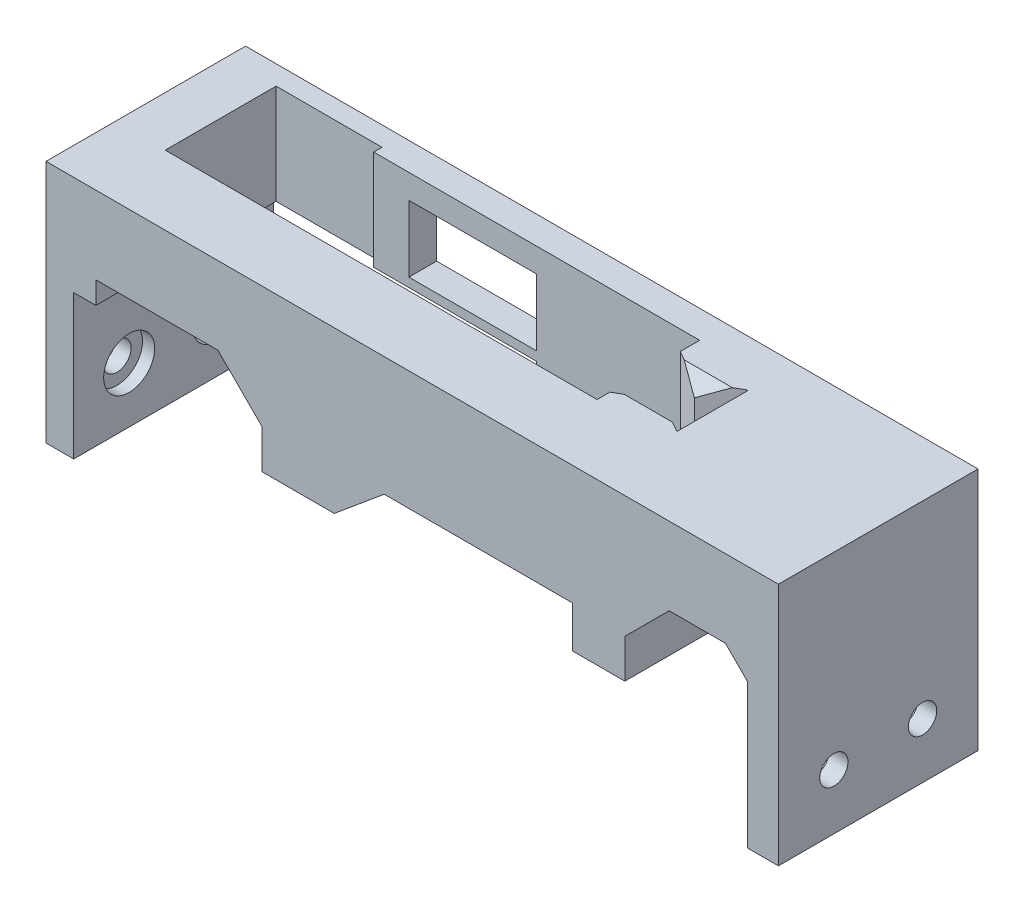
from build123d import *

# Parameters (mm, degrees)
SKETCH1_W                      = 132.1
SKETCH1_H                      = 36
BOSS_EXTRUDE1_DEPTH            = 44
CUT_EXTRUDE1_REACH             = 89.147
CUT_EXTRUDE2_REACH             = 89.147
SKETCH3_4_W                    = 23.05
SKETCH3_4_H                    = 12
SKETCH3_4_W_2                  = 52.5
SKETCH3_4_H_2                  = 26
CUT_EXTRUDE3_DEPTH             = 12.5
CUT_EXTRUDE6_DEPTH             = 7.5
CUT_EXTRUDE7_REACH             = 101.054
CUT_EXTRUDE8_REACH             = 137.7
SKETCH11_R                     = 2.55
CUT_EXTRUDE8_DIRECTION_2_REACH = 137.7
SKETCH11_6_R                   = 4.6
SKETCH11_6_R_2                 = 2.55
CUT_EXTRUDE10_DEPTH            = 2.2
CUT_EXTRUDE11_START            = 123.73
SKETCH11_7_R                   = 4.6
SKETCH11_7_R_2                 = 2.55
CUT_EXTRUDE11_DEPTH            = 2.2


with BuildPart() as part:
    # Sketch1 → Boss-Extrude1 (new body)
    with BuildSketch(Plane(origin=(0, 0, 0), x_dir=(1, 0, 0), z_dir=(0, 1, 0))):
        Rectangle(SKETCH1_W, SKETCH1_H)
        Polygon((-57.05, 14.5), (-57.05, -5.5), (20.85, -5.5), (20.85, -3.2), (26.85, 0.267693758), (32.85, -3.2), (33.05, -3.2), (33.05, 9.51), (32.85, 9.51), (26.85, 6.042306242), (20.85, 9.51), (20.85, 13), (-37.95, 13), (-37.95, 14.5), align=None, mode=Mode.SUBTRACT)
    extrude(amount=-BOSS_EXTRUDE1_DEPTH)

    # Cut-Extrude1: up to this face of the body (flat: up to its plane)
    cut_extrude1_end = Plane(part.part.faces().sort_by_distance((0, -22, 18))[0])
    # Sketch3 → Cut-Extrude1 (cut, up to the picked face)
    with BuildSketch(Plane(origin=(0, 0, -18), x_dir=(-1, 0, 0), z_dir=(0, 0, -1)), mode=Mode.PRIVATE) as cut_extrude1_sk1:
        Polygon((-60.48, -18), (-60.48, -44), (-20.85, -44), (-20.85, -29), (-38.35, -29), (-38.35, -22), (-46.35, -14), (-56.48, -14), align=None)
    cut_extrude1_tool1 = split(extrude(cut_extrude1_sk1.sketch, amount=-CUT_EXTRUDE1_REACH, mode=Mode.PRIVATE), bisect_by=cut_extrude1_end, keep=Keep.BOTH, mode=Mode.PRIVATE)
    add(cut_extrude1_tool1.solids().sort_by(Axis((43.76231, -31.789655, -18), (0, 0, 1)))[0], mode=Mode.SUBTRACT)

    # Cut-Extrude2: up to this face of the body (flat: up to its plane)
    cut_extrude2_end = Plane(part.part.faces().sort_by_distance((-18.1, -22, 5.5))[0])
    # Sketch3<4> → Cut-Extrude2 (cut, up to the picked face)
    with BuildSketch(Plane(origin=(0, 0, -18), x_dir=(-1, 0, 0), z_dir=(0, 0, -1)), mode=Mode.PRIVATE) as cut_extrude2_sk1:
        with Locations((20.075, -10.36)):
            Rectangle(SKETCH3_4_W, SKETCH3_4_H)
    cut_extrude2_tool1 = split(extrude(cut_extrude2_sk1.sketch, amount=-CUT_EXTRUDE2_REACH, mode=Mode.PRIVATE), bisect_by=cut_extrude2_end, keep=Keep.BOTH, mode=Mode.PRIVATE)
    # Sketch3<4> → Cut-Extrude2 (cut, up to the picked face)
    with BuildSketch(Plane(origin=(0, 0, -18), x_dir=(-1, 0, 0), z_dir=(0, 0, -1)), mode=Mode.PRIVATE) as cut_extrude2_sk2:
        with Locations((34.8, -31)):
            Rectangle(SKETCH3_4_W_2, SKETCH3_4_H_2)
    cut_extrude2_tool2 = split(extrude(cut_extrude2_sk2.sketch, amount=-CUT_EXTRUDE2_REACH, mode=Mode.PRIVATE), bisect_by=cut_extrude2_end, keep=Keep.BOTH, mode=Mode.PRIVATE)
    add(cut_extrude2_tool1.solids().sort_by(Axis((-20.075, -10.36, -18), (0, 0, 1)))[0], mode=Mode.SUBTRACT)
    add(cut_extrude2_tool2.solids().sort_by(Axis((-34.8, -31, -18), (0, 0, 1)))[0], mode=Mode.SUBTRACT)

    # Sketch4 → Cut-Extrude3 (cut)
    with BuildSketch(Plane.XY.offset(18)):
        Polygon((-61.05, -44), (-61.05, -18), (-57.05, -18), (-57.05, -14), (-35.05, -14), (-27.05, -22), (-27.05, -29), (-14.05, -29), (-5.05, -21.5), (20.85, -21.5), (20.85, -29), (20.85, -44), align=None)
    extrude(amount=-CUT_EXTRUDE3_DEPTH, mode=Mode.SUBTRACT)

    # Sketch7 → Cut-Extrude6 (cut)
    with BuildSketch(Plane.XZ.offset(29)):
        Polygon((20.85, 3.2), (23.35, 5.7), (23.35, 8), (29.35, 8), (28.95, 18), (20.85, 18), align=None)
    extrude(amount=-CUT_EXTRUDE6_DEPTH, mode=Mode.SUBTRACT)

    # Cut-Extrude7: up to this face of the body (flat: up to its plane)
    cut_extrude7_end = Plane(part.part.faces().sort_by_distance((33.05, -14.5, -3.155))[0])
    # Sketch10 → Cut-Extrude7 (cut, up to the picked face)
    with BuildSketch(Plane.ZY.offset(-20.85), mode=Mode.PRIVATE) as cut_extrude7_sk1:
        Polygon((-8.552306242, 0), (-6.042306242, 0), (-6.042306242, -2.51), align=None)
    cut_extrude7_tool1 = split(extrude(cut_extrude7_sk1.sketch, amount=-CUT_EXTRUDE7_REACH, mode=Mode.PRIVATE), bisect_by=cut_extrude7_end, keep=Keep.BOTH, mode=Mode.PRIVATE)
    # Sketch10 → Cut-Extrude7 (cut, up to the picked face)
    with BuildSketch(Plane.ZY.offset(-20.85), mode=Mode.PRIVATE) as cut_extrude7_sk2:
        Polygon((-0.267693758, 0), (-0.267693758, -2.51), (2.242306242, 0), align=None)
    cut_extrude7_tool2 = split(extrude(cut_extrude7_sk2.sketch, amount=-CUT_EXTRUDE7_REACH, mode=Mode.PRIVATE), bisect_by=cut_extrude7_end, keep=Keep.BOTH, mode=Mode.PRIVATE)
    # Sketch10 → Cut-Extrude7 (cut, up to the picked face)
    with BuildSketch(Plane.ZY.offset(-20.85), mode=Mode.PRIVATE) as cut_extrude7_sk3:
        Polygon((-9.51, -29), (-6.042306242, -25.532306242), (-6.042306242, -29), align=None)
    cut_extrude7_tool3 = split(extrude(cut_extrude7_sk3.sketch, amount=-CUT_EXTRUDE7_REACH, mode=Mode.PRIVATE), bisect_by=cut_extrude7_end, keep=Keep.BOTH, mode=Mode.PRIVATE)
    # Sketch10 → Cut-Extrude7 (cut, up to the picked face)
    with BuildSketch(Plane.ZY.offset(-20.85), mode=Mode.PRIVATE) as cut_extrude7_sk4:
        Polygon((-0.267693758, -25.532306242), (-0.267693758, -29), (3.2, -29), align=None)
    cut_extrude7_tool4 = split(extrude(cut_extrude7_sk4.sketch, amount=-CUT_EXTRUDE7_REACH, mode=Mode.PRIVATE), bisect_by=cut_extrude7_end, keep=Keep.BOTH, mode=Mode.PRIVATE)
    add(cut_extrude7_tool1.solids().sort_by(Axis((20.85, -0.836667, -6.878973), (1, 0, 0)))[0], mode=Mode.SUBTRACT)
    add(cut_extrude7_tool2.solids().sort_by(Axis((20.85, -0.836667, 0.568973), (1, 0, 0)))[0], mode=Mode.SUBTRACT)
    add(cut_extrude7_tool3.solids().sort_by(Axis((20.85, -27.844102, -7.198204), (1, 0, 0)))[0], mode=Mode.SUBTRACT)
    add(cut_extrude7_tool4.solids().sort_by(Axis((20.85, -27.844102, 0.888204), (1, 0, 0)))[0], mode=Mode.SUBTRACT)

    # Cut-Extrude8: up to this face of the body (flat: up to its plane)
    cut_extrude8_end = Plane(part.part.faces().sort_by_distance((-66.05, -22, 0))[0])
    # Sketch11 → Cut-Extrude8 (cut, up to the picked face)
    with BuildSketch(Plane(origin=(-61.05, 0, 0), x_dir=(0, 0, -1), z_dir=(1, 0, 0)), mode=Mode.PRIVATE) as cut_extrude8_sk1:
        with Locations((-8, -34)):
            Circle(SKETCH11_R)
    cut_extrude8_tool1 = split(extrude(cut_extrude8_sk1.sketch, amount=-CUT_EXTRUDE8_REACH, mode=Mode.PRIVATE), bisect_by=cut_extrude8_end, keep=Keep.BOTH, mode=Mode.PRIVATE)
    # Sketch11 → Cut-Extrude8 (cut, up to the picked face)
    with BuildSketch(Plane(origin=(-61.05, 0, 0), x_dir=(0, 0, -1), z_dir=(1, 0, 0)), mode=Mode.PRIVATE) as cut_extrude8_sk2:
        with Locations((8, -34)):
            Circle(SKETCH11_R)
    cut_extrude8_tool2 = split(extrude(cut_extrude8_sk2.sketch, amount=-CUT_EXTRUDE8_REACH, mode=Mode.PRIVATE), bisect_by=cut_extrude8_end, keep=Keep.BOTH, mode=Mode.PRIVATE)
    add(cut_extrude8_tool1.solids().sort_by(Axis((-61.05, -34, 8), (-1, 0, 0)))[0], mode=Mode.SUBTRACT)
    add(cut_extrude8_tool2.solids().sort_by(Axis((-61.05, -34, -8), (-1, 0, 0)))[0], mode=Mode.SUBTRACT)

    # Cut-Extrude8 direction 2: up to this face of the body (flat: up to its plane)
    cut_extrude8_direction_2_end = Plane(part.part.faces().sort_by_distance((66.05, -22, 0))[0])
    # Sketch11 → Cut-Extrude8 direction 2 (cut, up to the picked face)
    with BuildSketch(Plane(origin=(-61.05, 0, 0), x_dir=(0, 0, -1), z_dir=(1, 0, 0)), mode=Mode.PRIVATE) as cut_extrude8_direction_2_sk1:
        with Locations((-8, -34)):
            Circle(SKETCH11_R)
    cut_extrude8_direction_2_tool1 = split(extrude(cut_extrude8_direction_2_sk1.sketch, amount=CUT_EXTRUDE8_DIRECTION_2_REACH, mode=Mode.PRIVATE), bisect_by=cut_extrude8_direction_2_end, keep=Keep.BOTH, mode=Mode.PRIVATE)
    # Sketch11 → Cut-Extrude8 direction 2 (cut, up to the picked face)
    with BuildSketch(Plane(origin=(-61.05, 0, 0), x_dir=(0, 0, -1), z_dir=(1, 0, 0)), mode=Mode.PRIVATE) as cut_extrude8_direction_2_sk2:
        with Locations((8, -34)):
            Circle(SKETCH11_R)
    cut_extrude8_direction_2_tool2 = split(extrude(cut_extrude8_direction_2_sk2.sketch, amount=CUT_EXTRUDE8_DIRECTION_2_REACH, mode=Mode.PRIVATE), bisect_by=cut_extrude8_direction_2_end, keep=Keep.BOTH, mode=Mode.PRIVATE)
    add(cut_extrude8_direction_2_tool1.solids().sort_by(Axis((-61.05, -34, 8), (1, 0, 0)))[0], mode=Mode.SUBTRACT)
    add(cut_extrude8_direction_2_tool2.solids().sort_by(Axis((-61.05, -34, -8), (1, 0, 0)))[0], mode=Mode.SUBTRACT)

    # Sketch11<6> → Cut-Extrude10 (cut)
    # profile 1 of 2: a face of its own
    with BuildSketch(Plane(origin=(-61.05, 0, 0), x_dir=(0, 0, -1), z_dir=(1, 0, 0))):
        with Locations((-8, -34)):
            Circle(SKETCH11_6_R)
        with Locations((-8, -34)):
            Circle(SKETCH11_6_R_2, mode=Mode.SUBTRACT)
    # profile 2 of 2: a face of its own
    with BuildSketch(Plane(origin=(-61.05, 0, 0), x_dir=(0, 0, -1), z_dir=(1, 0, 0))):
        with Locations(Location((8, -34, 0), (0, 0, 180))):
            Circle(SKETCH11_6_R)
        with Locations(Location((8, -34, 0), (0, 0, 180))):
            Circle(SKETCH11_6_R_2, mode=Mode.SUBTRACT)
    extrude(amount=-CUT_EXTRUDE10_DEPTH, mode=Mode.SUBTRACT)

    # Sketch11<7> → Cut-Extrude11 (cut)
    # profile 1 of 2: a face of its own
    with BuildSketch(Plane(origin=(-61.05, 0, 0), x_dir=(0, 0, -1), z_dir=(1, 0, 0)).offset(CUT_EXTRUDE11_START)):
        with Locations((-8, -34)):
            Circle(SKETCH11_7_R)
        with Locations((-8, -34)):
            Circle(SKETCH11_7_R_2, mode=Mode.SUBTRACT)
    # profile 2 of 2: a face of its own
    with BuildSketch(Plane(origin=(-61.05, 0, 0), x_dir=(0, 0, -1), z_dir=(1, 0, 0)).offset(CUT_EXTRUDE11_START)):
        with Locations(Location((8, -34, 0), (0, 0, 180))):
            Circle(SKETCH11_7_R)
        with Locations((8, -34)):
            Circle(SKETCH11_7_R_2, mode=Mode.SUBTRACT)
    extrude(amount=-CUT_EXTRUDE11_DEPTH, mode=Mode.SUBTRACT)


solid = part.part
